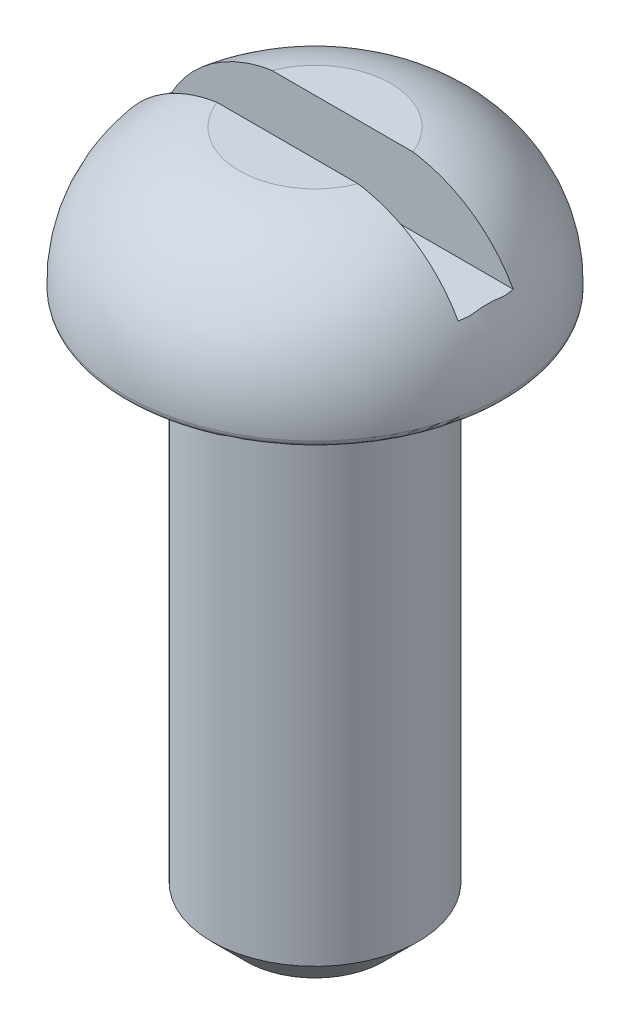
from build123d import *

# Parameters (mm, degrees)
FILLET_1_R          = 0.1
SKETCH_3_W          = 5
SKETCH_3_H          = 0.8
CUT_EXTRUDE_2_DEPTH = 1


with BuildPart() as part:
    # Эскиз1 → Повернуть1 (revolve)
    with BuildSketch(Plane.XY):
        with BuildLine():
            Line((2.75, 7.9), (1.5, 7.9))
            Line((1.5, 7.9), (1.5, 0.5))
            Line((1.5, 0.5), (1, 0))
            Line((1, 0), (0, 0))
            Line((0, 0), (0, 10))
            Line((0, 10), (1.1, 10))
            ThreePointArc((1.1, 10), (2.333466256, 9.270937772), (2.75, 7.9))
        make_face()
    revolve(axis=Axis((0, 0, 0), (0, 1, 0)))

    # Скругление1
    fillet_1_edges = [part.edges().sort_by_distance(p)[0] for p in [
        (-2.75, 7.9, 0),
    ]]
    fillet(fillet_1_edges, radius=FILLET_1_R)

    # Эскиз3 → Вырез-Вытянуть2 (cut)
    with BuildSketch(Plane(origin=(0, 10, 0), x_dir=(-1, 0, 0), z_dir=(0, 1, 0))):
        Rectangle(SKETCH_3_W, SKETCH_3_H)
    extrude(amount=-CUT_EXTRUDE_2_DEPTH, mode=Mode.SUBTRACT)


solid = part.part
